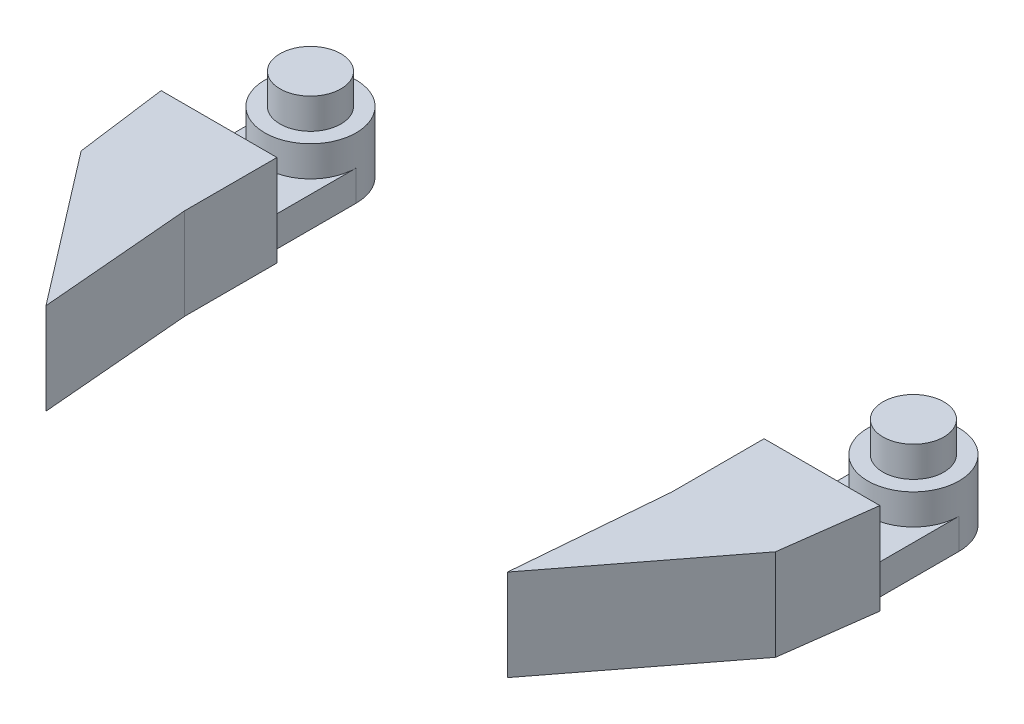
from build123d import *

# Parameters (mm, degrees)
SKETCH1_R           = 7.5
SKETCH1_R_2         = 5
BOSS_EXTRUDE1_DEPTH = 10
BOSS_EXTRUDE2_DEPTH = 15
BOSS_EXTRUDE3_DEPTH = 5
SKETCH1_5_R         = 5
BOSS_EXTRUDE4_DEPTH = 15
SKETCH1_6_R         = 5
BOSS_EXTRUDE5_DEPTH = 15
SKETCH1_7_R         = 7.5
SKETCH1_7_R_2       = 5
BOSS_EXTRUDE6_DEPTH = 10
BOSS_EXTRUDE7_DEPTH = 5
BOSS_EXTRUDE8_DEPTH = 15


with BuildPart() as part:
    # Sketch1 → Boss-Extrude1 (new body)
    with BuildSketch(Plane(origin=(0, 0, 0), x_dir=(1, 0, 0), z_dir=(0, 1, 0))):
        Circle(SKETCH1_R)
        Circle(SKETCH1_R_2, mode=Mode.SUBTRACT)
    extrude(amount=BOSS_EXTRUDE1_DEPTH)



with BuildPart() as body_2:
    # Sketch1<3> → Boss-Extrude2 (new body)
    with BuildSketch(Plane(origin=(0, 0, 0), x_dir=(1, 0, 0), z_dir=(0, 1, 0))):
        Polygon((-7.5, -15), (-9.5, -15), (-7.5, -30.12715853), (11.607364561, -55), (9.5, -30.12715853), (9.5, -15), (7.5, -15), align=None)
    extrude(amount=BOSS_EXTRUDE2_DEPTH)


with BuildPart() as part_1:
    add(part.part)

    add(body_2.part)  # Boss-Extrude3 merges body 2
    # Sketch1<4> → Boss-Extrude3 (add)
    with BuildSketch(Plane(origin=(0, 0, 0), x_dir=(1, 0, 0), z_dir=(0, 1, 0))):
        with BuildLine():
            Line((-7.5, 0), (-7.5, -15))
            Line((-7.5, -15), (7.5, -15))
            Line((7.5, -15), (7.5, 0))
            ThreePointArc((7.5, 0), (0, -7.5), (-7.5, 0))
        make_face()
    extrude(amount=BOSS_EXTRUDE3_DEPTH)

    # Sketch1<5> → Boss-Extrude4 (add)
    with BuildSketch(Plane(origin=(0, 0, 0), x_dir=(1, 0, 0), z_dir=(0, 1, 0))):
        Circle(SKETCH1_5_R)
    extrude(amount=BOSS_EXTRUDE4_DEPTH)


with BuildPart() as body_2_2:
    # Sketch1<6> → Boss-Extrude5 (new body)
    with BuildSketch(Plane(origin=(0, 0, 0), x_dir=(1, 0, 0), z_dir=(0, 1, 0))):
        with Locations((98.929018633, 0)):
            Circle(SKETCH1_6_R)
    extrude(amount=BOSS_EXTRUDE5_DEPTH)

    # Sketch1<7> → Boss-Extrude6 (add)
    with BuildSketch(Plane(origin=(0, 0, 0), x_dir=(1, 0, 0), z_dir=(0, 1, 0))):
        with Locations((98.929018633, 0)):
            Circle(SKETCH1_7_R)
        with Locations((98.929018633, 0)):
            Circle(SKETCH1_7_R_2, mode=Mode.SUBTRACT)
    extrude(amount=BOSS_EXTRUDE6_DEPTH)

    # Sketch1<8> → Boss-Extrude7 (add)
    with BuildSketch(Plane(origin=(0, 0, 0), x_dir=(1, 0, 0), z_dir=(0, 1, 0))):
        with BuildLine():
            ThreePointArc((106.429018633, 0), (98.929018633, -7.5), (91.429018633, 0))
            Line((91.429018633, 0), (91.429018633, -15))
            Line((91.429018633, -15), (106.429018633, -15))
            Line((106.429018633, -15), (106.429018633, 0))
        make_face()
    extrude(amount=BOSS_EXTRUDE7_DEPTH)

    # Sketch1<9> → Boss-Extrude8 (add)
    with BuildSketch(Plane(origin=(0, 0, 0), x_dir=(1, 0, 0), z_dir=(0, 1, 0))):
        Polygon((106.429018633, -15), (91.429018633, -15), (89.429018633, -15), (89.429018633, -30.12715853), (87.321654073, -55), (106.429018633, -30.12715853), (108.429018633, -15), align=None)
    extrude(amount=BOSS_EXTRUDE8_DEPTH)


solid = Compound([part_1.part, body_2_2.part])
